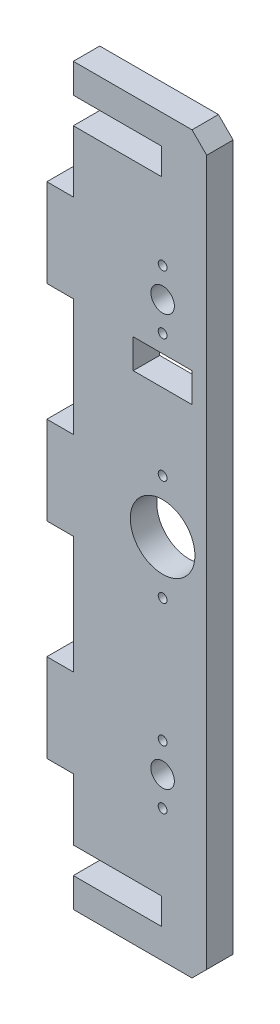
from build123d import *

# Parameters (mm, degrees)
MODEL_R             = 11
MODEL_R_2           = 4
MODEL_R_3           = 1.5
MODEL_W             = 20
MODEL_H             = 10
BOSS_EXTRUDE1_DEPTH = 9


with BuildPart() as part:
    # Model → Boss-Extrude1 (new body)
    with BuildSketch(Plane.XY):
        Polygon((0, 70), (0, 110), (-9, 110), (-9, 140), (0, 140), (0, 180), (-9, 180), (-9, 210), (0, 210), (0, 231), (30, 231), (30, 240), (0, 240), (0, 250), (40.4, 250), (45.4, 245), (45.4, 5), (40.4, 0), (0, 0), (0, 10), (30, 10), (30, 19), (0, 19), (0, 40), (-9, 40), (-9, 70), align=None)
        with Locations((30.4, 125)):
            Circle(MODEL_R, mode=Mode.SUBTRACT)
        with Locations((30.4, 195)):
            Circle(MODEL_R_2, mode=Mode.SUBTRACT)
        with Locations(Location((30.4, 55, 0), (0, 0, 180))):
            Circle(MODEL_R_2, mode=Mode.SUBTRACT)
        with Locations((30.4, 205)):
            Circle(MODEL_R_3, mode=Mode.SUBTRACT)
        with Locations((30.4, 185)):
            Circle(MODEL_R_3, mode=Mode.SUBTRACT)
        with Locations(Location((30.4, 65, 0), (0, 0, 180))):
            Circle(MODEL_R_3, mode=Mode.SUBTRACT)
        with Locations(Location((30.4, 45, 0), (0, 0, 180))):
            Circle(MODEL_R_3, mode=Mode.SUBTRACT)
        with Locations((30.4, 143)):
            Circle(MODEL_R_3, mode=Mode.SUBTRACT)
        with Locations(Location((30.4, 107, 0), (0, 0, 180))):
            Circle(MODEL_R_3, mode=Mode.SUBTRACT)
        with Locations((30.4, 174)):
            Rectangle(MODEL_W, MODEL_H, mode=Mode.SUBTRACT)
    extrude(amount=BOSS_EXTRUDE1_DEPTH)


solid = part.part
